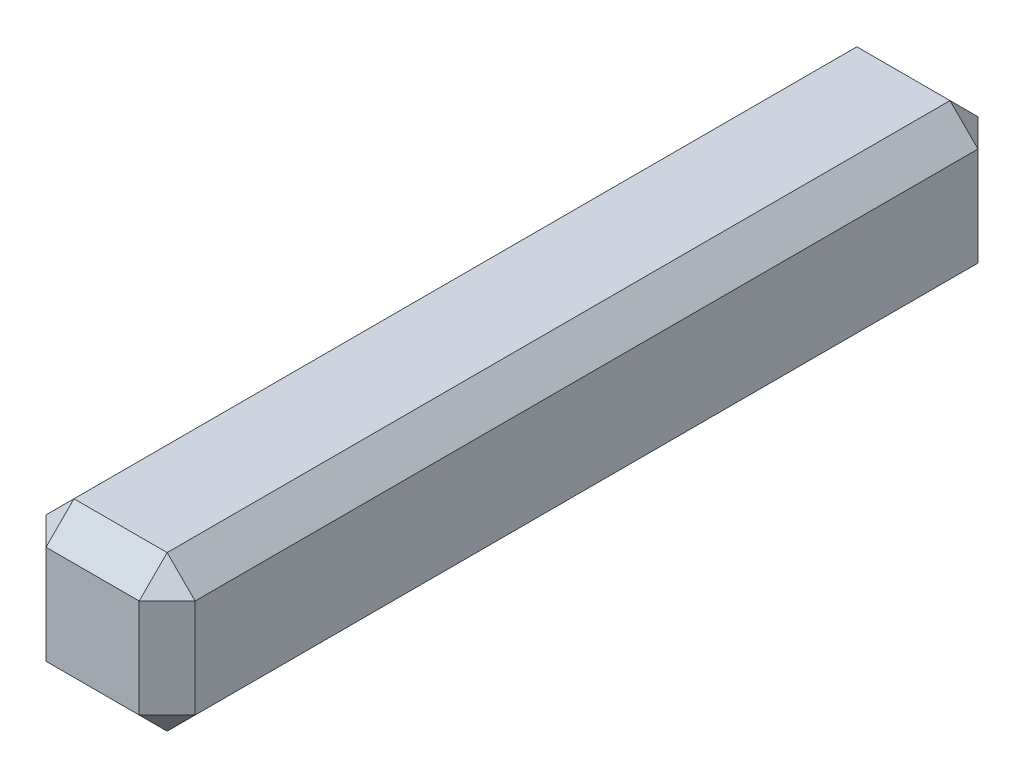
from build123d import *

# Parameters (mm, degrees)
SKETCH1_W           = 8
SKETCH1_H           = 8.3
BOSS_EXTRUDE1_DEPTH = 45
CHAMFER1_SIZE       = 1.5


with BuildPart() as part:
    # Sketch1 → Boss-Extrude1 (new body)
    with BuildSketch(Plane.XY):
        with Locations((-0.340337416, 0.353)):
            Rectangle(SKETCH1_W, SKETCH1_H)
    extrude(amount=BOSS_EXTRUDE1_DEPTH)

    # Chamfer1
    chamfer1_edges = [part.edges().sort_by_distance(p)[0] for p in [
        (3.659662584, 0.353, 45),
        (-0.340337416, 4.503, 45),
        (-4.340337416, 0.353, 45),
        (-0.340337416, 4.503, 0),
        (3.659662584, 0.353, 0),
        (-0.340337416, -3.797, 0),
        (-4.340337416, 0.353, 0),
        (-4.340337416, 4.503, 22.5),
        (3.659662584, 4.503, 22.5),
        (3.659662584, -3.797, 22.5),
        (-4.340337416, -3.797, 22.5),
        (-0.340337416, -3.797, 45),
    ]]
    chamfer(chamfer1_edges, length=CHAMFER1_SIZE)


solid = part.part
